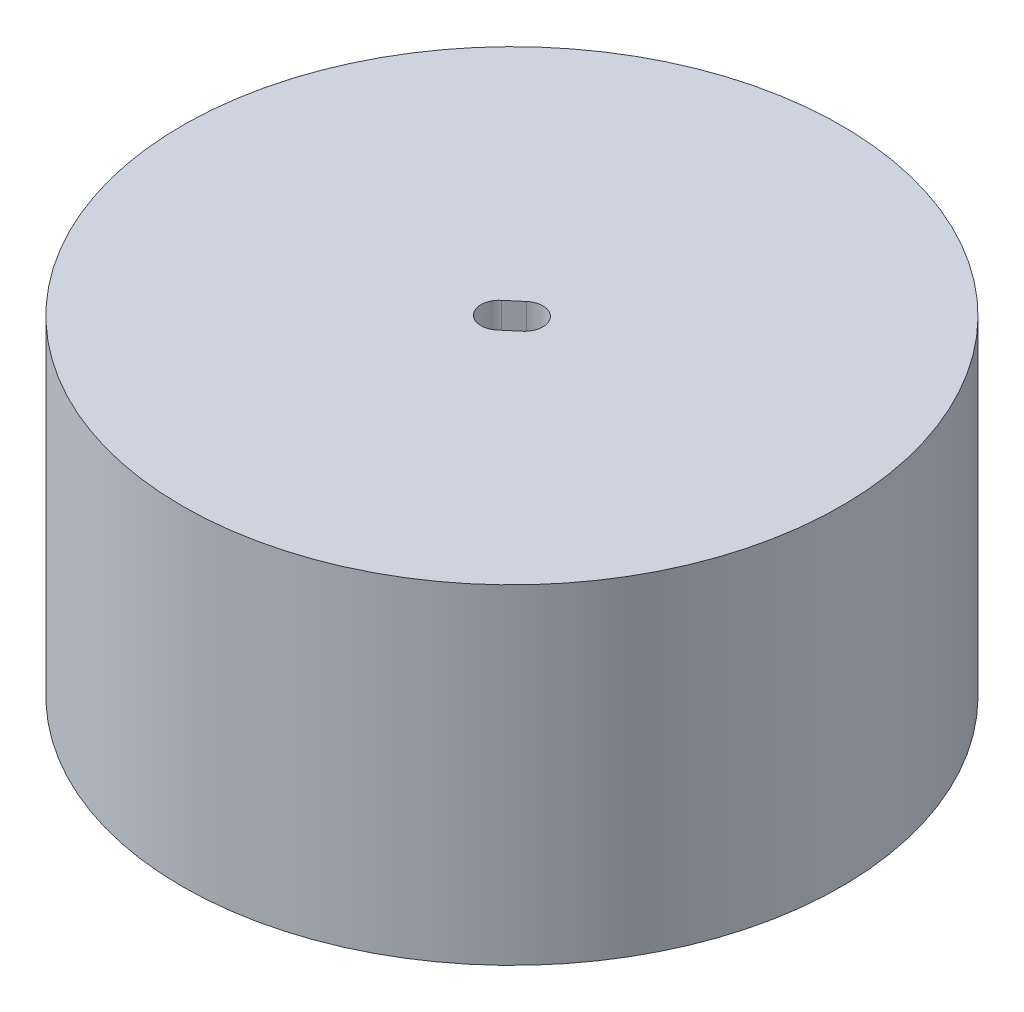
from build123d import *

# Parameters (mm, degrees)
SKETCH1_R           = 32
BOSS_EXTRUDE1_DEPTH = 32
CUT_EXTRUDE1_DEPTH  = 56.425625842


with BuildPart() as part:
    # Sketch1 → Boss-Extrude1 (new body)
    with BuildSketch(Plane(origin=(0, 0, 0), x_dir=(1, 0, 0), z_dir=(0, 1, 0))):
        with Locations(Location((0, 0, 0), (0, 0, 270))):
            Circle(SKETCH1_R)
    extrude(amount=BOSS_EXTRUDE1_DEPTH)

    # Sketch2 → Cut-Extrude1 (cut, through all)
    with BuildSketch(Plane(origin=(0, 32, 0), x_dir=(1, 0, 0), z_dir=(0, 1, 0))):
        with BuildLine():
            Line((-1.810696161, 0.793034938), (-0.482407729, 1.916978816))
            ThreePointArc((-0.482407729, 1.916978816), (2.019151093, 1.708523884), (1.810696161, -0.793034938))
            Line((1.810696161, -0.793034938), (0.482407729, -1.916978816))
            ThreePointArc((0.482407729, -1.916978816), (-2.019151093, -1.708523884), (-1.810696161, 0.793034938))
        make_face()
    extrude(amount=-CUT_EXTRUDE1_DEPTH, mode=Mode.SUBTRACT)


solid = part.part
